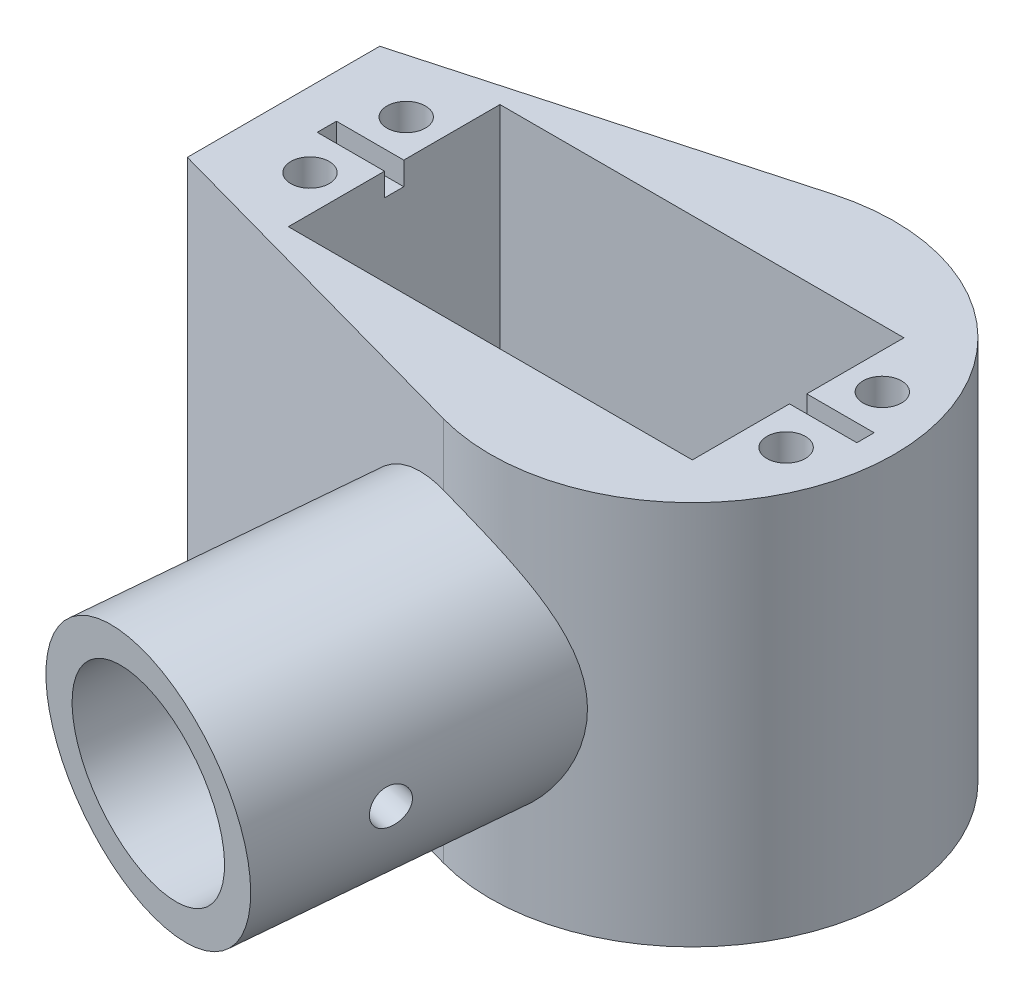
from build123d import *

# Parameters (mm, degrees)
SKETCH1_W           = 7.25
SKETCH1_H           = 20
SKETCH1_R           = 6
BOSS_EXTRUDE1_DEPTH = 40
SKETCH2_W           = 42
SKETCH2_H           = 22
CUT_EXTRUDE1_DEPTH  = 25
SKETCH3_R           = 2
CUT_EXTRUDE2_DEPTH  = 12
SKETCH4_R           = 9.5
CUT_EXTRUDE3_DEPTH  = 5
CUT_EXTRUDE4_START  = -6
SKETCH5_R           = 9.5
CUT_EXTRUDE4_DEPTH  = 6
SKETCH7_W           = 7
SKETCH7_H           = 2
SKETCH7_H_2         = 1.8
CUT_EXTRUDE5_DEPTH  = 2.4
BOSS_EXTRUDE2_REACH = 87.524
SKETCH9_R           = 13.5
SKETCH9_R_2         = 10.05
BOSS_EXTRUDE3_REACH = 71.909
SKETCH10_R          = 10.05
SKETCH11_R          = 1.9
CUT_EXTRUDE7_DEPTH  = 13.5


with BuildPart() as part:
    # Sketch1 → Boss-Extrude1 (new body)
    # profile 1 of 6: a face of its own
    with BuildSketch(Plane(origin=(0, 0, 0), x_dir=(1, 0, 0), z_dir=(0, 1, 0))):
        with BuildLine():
            Line((-30.25, -10), (-37.5, -10))
            Line((-37.5, -10), (-37.5, 10))
            Line((-37.5, 10), (-30.25, 10))
            Line((-30.25, 10), (-18.466185313, 10))
            ThreePointArc((-18.466185313, 10), (-13.083157843, 16.426532831), (-5.61521172, 20.235350191))
            Line((-5.61521172, 20.235350191), (-42.5, 10))
            Line((-42.5, 10), (-42.5, -10))
            Line((-42.5, -10), (-5.61521172, -20.235350191))
            ThreePointArc((-5.61521172, -20.235350191), (-13.083157843, -16.426532831), (-18.466185313, -10))
            Line((-18.466185313, -10), (-30.25, -10))
        make_face()
    # profile 2 of 6: a face of its own
    with BuildSketch(Plane(origin=(0, 0, 0), x_dir=(1, 0, 0), z_dir=(0, 1, 0))):
        with Locations((-33.875, 0)):
            Rectangle(SKETCH1_W, SKETCH1_H)
    # profile 3 of 6: a face of its own
    with BuildSketch(Plane(origin=(0, 0, 0), x_dir=(1, 0, 0), z_dir=(0, 1, 0))):
        with BuildLine():
            ThreePointArc((-18.466185313, 10), (-21, 0), (-18.466185313, -10))
            Line((-18.466185313, -10), (9.75, -10))
            Line((9.75, -10), (9.75, 10))
            Line((9.75, 10), (-18.466185313, 10))
        make_face()
        with Locations(Location((0, 0, 0), (0, 0, 270))):
            Circle(SKETCH1_R, mode=Mode.SUBTRACT)
    # profile 4 of 6: a face of its own
    with BuildSketch(Plane(origin=(0, 0, 0), x_dir=(1, 0, 0), z_dir=(0, 1, 0))):
        with BuildLine():
            Line((-30.25, 10), (-30.25, -10))
            Line((-30.25, -10), (-18.466185313, -10))
            ThreePointArc((-18.466185313, -10), (-21, 0), (-18.466185313, 10))
            Line((-18.466185313, 10), (-30.25, 10))
        make_face()
    # profile 5 of 6: a face of its own
    with BuildSketch(Plane(origin=(0, 0, 0), x_dir=(1, 0, 0), z_dir=(0, 1, 0))):
        with BuildLine():
            Line((9.75, -10), (-18.466185313, -10))
            ThreePointArc((-18.466185313, -10), (-13.083157843, -16.426532831), (-5.61521172, -20.235350191))
            ThreePointArc((-5.61521172, -20.235350191), (12.709849603, -16.717048874), (21, 0))
            ThreePointArc((21, 0), (12.709849603, 16.717048874), (-5.61521172, 20.235350191))
            ThreePointArc((-5.61521172, 20.235350191), (-13.083157843, 16.426532831), (-18.466185313, 10))
            Line((-18.466185313, 10), (9.75, 10))
            Line((9.75, 10), (17, 10))
            Line((17, 10), (17, -10))
            Line((17, -10), (9.75, -10))
        make_face()
    # profile 6 of 6: a face of its own
    with BuildSketch(Plane(origin=(0, 0, 0), x_dir=(1, 0, 0), z_dir=(0, 1, 0))):
        with Locations((13.375, 0)):
            Rectangle(SKETCH1_W, SKETCH1_H)
    extrude(amount=BOSS_EXTRUDE1_DEPTH)

    # Sketch2 → Cut-Extrude1 (cut)
    with BuildSketch(Plane(origin=(0, 40, 0), x_dir=(1, 0, 0), z_dir=(0, 1, 0))):
        with Locations((-10, 0)):
            Rectangle(SKETCH2_W, SKETCH2_H)
    extrude(amount=-CUT_EXTRUDE1_DEPTH, mode=Mode.SUBTRACT)

    # Sketch3 → Cut-Extrude2 (cut)
    with BuildSketch(Plane(origin=(0, 40, 0), x_dir=(1, 0, 0), z_dir=(0, 1, 0))):
        with Locations(Location((14.75, 5, 0), (0, 0, 270))):
            Circle(SKETCH3_R)
        with Locations(Location((14.75, -5, 0), (0, 0, 270))):
            Circle(SKETCH3_R)
        with Locations(Location((-34.75, 5, 0), (0, 0, 270))):
            Circle(SKETCH3_R)
        with Locations(Location((-34.75, -5, 0), (0, 0, 270))):
            Circle(SKETCH3_R)
    extrude(amount=-CUT_EXTRUDE2_DEPTH, mode=Mode.SUBTRACT)

    # Sketch4 → Cut-Extrude3 (cut)
    with BuildSketch(Plane(origin=(0, 15, 0), x_dir=(1, 0, 0), z_dir=(0, 1, 0))):
        with Locations(Location((0, 0, 0), (0, 0, 270))):
            Circle(SKETCH4_R)
    extrude(amount=-CUT_EXTRUDE3_DEPTH, mode=Mode.SUBTRACT)

    # Sketch5 → Cut-Extrude4 (cut)
    with BuildSketch(Plane.XZ.offset(CUT_EXTRUDE4_START)):
        with Locations(Location((0, 0, 0), (0, 0, 90))):
            Circle(SKETCH5_R)
    extrude(amount=CUT_EXTRUDE4_DEPTH, mode=Mode.SUBTRACT)

    # Sketch7 → Cut-Extrude5 (cut)
    with BuildSketch(Plane(origin=(0, 40, 0), x_dir=(1, 0, 0), z_dir=(0, 1, 0))):
        with Locations((-34.5, 0)):
            Rectangle(SKETCH7_W, SKETCH7_H)
        with Locations((14.5, 0)):
            Rectangle(SKETCH7_W, SKETCH7_H_2)
    extrude(amount=-CUT_EXTRUDE5_DEPTH, mode=Mode.SUBTRACT)

    # Sketch9 → Boss-Extrude2 (add, up to next)
    with BuildSketch(Plane(origin=(-8.961867673, -4.60437291, 43.807681948), x_dir=(0, 0.9945218953682737, 0.10452846326765038), z_dir=(0.1993679344171976, 0.10243002349202152, -0.9745565745577032)), mode=Mode.PRIVATE) as boss_extrude2_sk1:
        with Locations(Location((22.005607966, -1.9070974, 0), (0, 0, 178.799576176))):
            Circle(SKETCH9_R)
        with Locations(Location((22.005607966, -1.9070974, 0), (0, 0, 178.799576176))):
            Circle(SKETCH9_R_2, mode=Mode.SUBTRACT)
    boss_extrude2_tool1 = extrude(boss_extrude2_sk1.sketch, amount=BOSS_EXTRUDE2_REACH, mode=Mode.PRIVATE) - part.part
    add(boss_extrude2_tool1.solids().sort_by_distance((-11.099985, 30.369593, 47.046193))[0])

    # Sketch10 → Boss-Extrude3 (add, up to next)
    with BuildSketch(Plane(origin=(-3.977669313, -2.043622323, 19.443767584), x_dir=(0.9799247046208295, -0.020839623809475377, 0.19827577601224913), z_dir=(-0.19936793441719772, -0.10243002349202134, 0.9745565745577032)), mode=Mode.PRIVATE) as boss_extrude3_sk1:
        with Locations(Location((-1.9070974, 22.005607966, 0), (0, 0, 1.200423824))):
            Circle(SKETCH10_R)
    boss_extrude3_tool1 = extrude(boss_extrude3_sk1.sketch, amount=-BOSS_EXTRUDE3_REACH, mode=Mode.PRIVATE) - part.part
    add(boss_extrude3_tool1.solids().sort_by_distance((-5.846481, 19.88118, 21.365849))[0])

    # Sketch11 → Cut-Extrude7 (cut, symmetric)
    with BuildSketch(Plane(origin=(-1.868811857, 0.039743192, -0.378131217), x_dir=(-0.19936793441719755, -0.10243002349202149, 0.9745565745577031), z_dir=(-0.9799247046208296, 0.02083962380947537, -0.19827577601224902))):
        with Locations(Location((32.45139953, 22.005607966, 0), (0, 0, 5.880400839))):
            Circle(SKETCH11_R)
    extrude(amount=CUT_EXTRUDE7_DEPTH, both=True, mode=Mode.SUBTRACT)


solid = part.part
